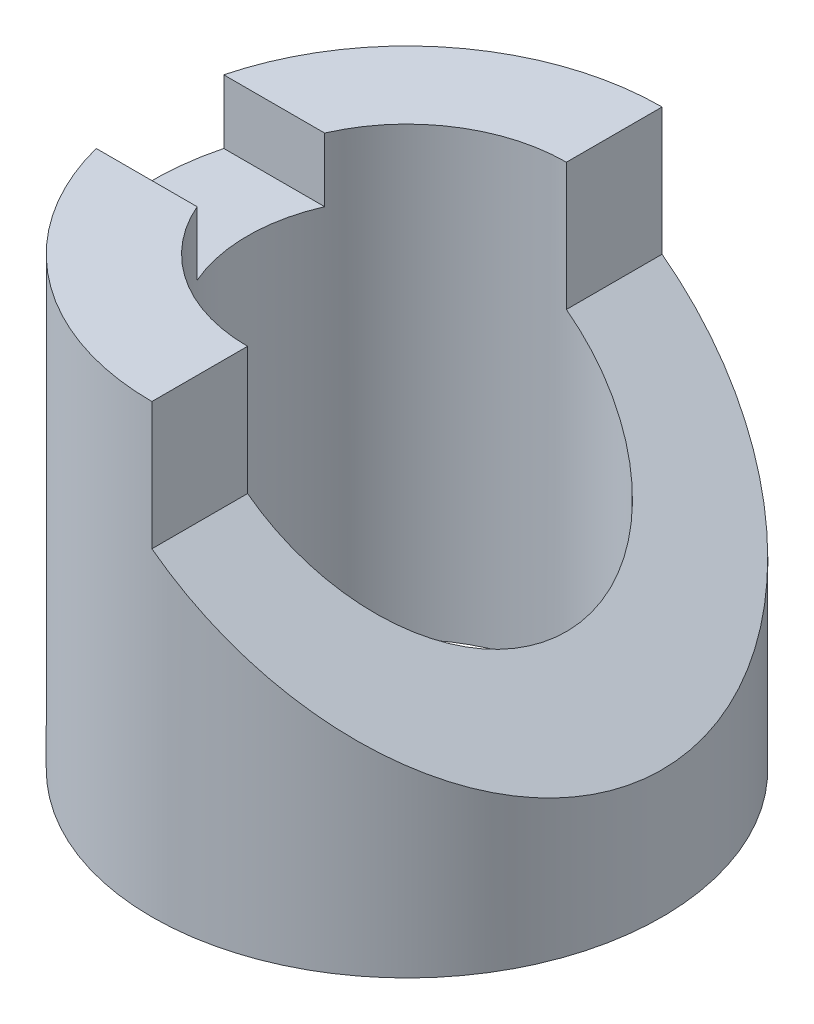
from build123d import *

# Parameters (mm, degrees)
SKETCH1_R               = 40
SKETCH1_R_2             = 25
BOSS_EXTRUDE1_DEPTH     = 70
CUT_EXTRUDE1_DEPTH      = 70
CUT_EXTRUDE1_DEPTH_BACK = 70
SKETCH3_W               = 20
SKETCH3_H               = 10
CUT_EXTRUDE2_DEPTH      = 70


with BuildPart() as part:
    # Sketch1 → Boss-Extrude1 (new body)
    with BuildSketch(Plane(origin=(0, 0, 0), x_dir=(1, 0, 0), z_dir=(0, 1, 0))):
        Circle(SKETCH1_R)
        Circle(SKETCH1_R_2, mode=Mode.SUBTRACT)
    extrude(amount=BOSS_EXTRUDE1_DEPTH)

    # Sketch2 → Cut-Extrude1 (cut, two sides: drawn at the far end of the back side and taken through both)
    with BuildSketch(Plane.XY.offset(-CUT_EXTRUDE1_DEPTH_BACK)):
        Polygon((0, 70), (40, 70), (40, 20), (0, 50), align=None)
    extrude(amount=CUT_EXTRUDE1_DEPTH + CUT_EXTRUDE1_DEPTH_BACK, mode=Mode.SUBTRACT)

    # Sketch3 → Cut-Extrude2 (cut)
    with BuildSketch(Plane(origin=(0, 0, 0), x_dir=(0, 0, -1), z_dir=(1, 0, 0))):
        with Locations((0, 65)):
            Rectangle(SKETCH3_W, SKETCH3_H)
    extrude(amount=-CUT_EXTRUDE2_DEPTH, mode=Mode.SUBTRACT)


solid = part.part
